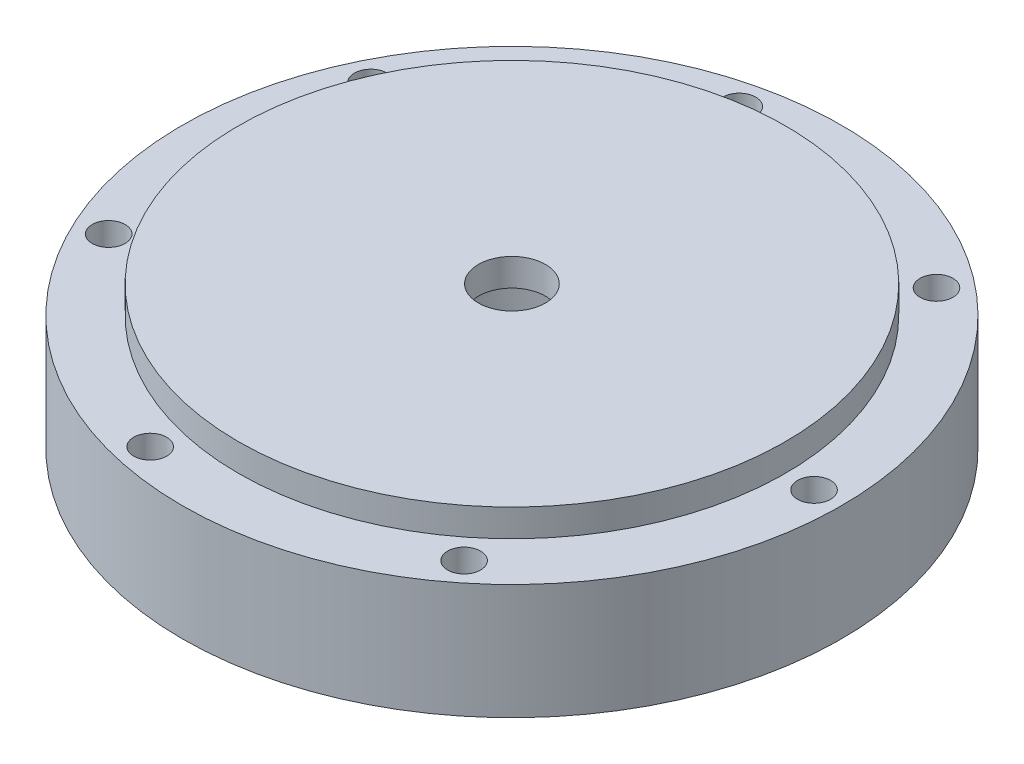
from build123d import *

# Parameters (mm, degrees)
CROQUIS1_R              = 24.9
CROQUIS1_R_2            = 3.05
SALIENTE_EXTRUIR1_DEPTH = 2.5
CROQUIS2_R              = 30
SALIENTE_EXTRUIR2_DEPTH = 10.5
CROQUIS3_R              = 1.5
CORTAR_EXTRUIR1_DEPTH   = 44.706406853


with BuildPart() as part:
    # Croquis1 → Saliente-Extruir1 (new body)
    with BuildSketch(Plane(origin=(0, 0, 0), x_dir=(1, 0, 0), z_dir=(0, 1, 0))):
        with Locations(Location((0, 0, 0), (0, 0, 270))):
            Circle(CROQUIS1_R)
        with Locations(Location((0, 0, 0), (0, 0, 270))):
            Circle(CROQUIS1_R_2, mode=Mode.SUBTRACT)
    extrude(amount=SALIENTE_EXTRUIR1_DEPTH)

    # Croquis2 → Saliente-Extruir2 (add)
    with BuildSketch(Plane(origin=(0, 0, 0), x_dir=(1, 0, 0), z_dir=(0, 1, 0))):
        with Locations(Location((0, 0, 0), (0, 0, 270))):
            Circle(CROQUIS2_R)
        with BuildLine():
            Line((-4.135214626, 9.05), (4.135214626, 9.05))
            ThreePointArc((4.135214626, 9.05), (4.370264873, 9.021983221), (4.592144419, 8.939502762))
            ThreePointArc((4.592144419, 8.939502762), (10.05, 0), (4.592144419, -8.939502762))
            ThreePointArc((4.592144419, -8.939502762), (4.370264873, -9.021983221), (4.135214626, -9.05))
            Line((4.135214626, -9.05), (-4.135214626, -9.05))
            ThreePointArc((-4.135214626, -9.05), (-4.370264873, -9.021983221), (-4.592144419, -8.939502762))
            ThreePointArc((-4.592144419, -8.939502762), (-10.05, 0), (-4.592144419, 8.939502762))
            ThreePointArc((-4.592144419, 8.939502762), (-4.370264873, 9.021983221), (-4.135214626, 9.05))
        make_face(mode=Mode.SUBTRACT)
    extrude(amount=-SALIENTE_EXTRUIR2_DEPTH)

    # Croquis3 → Cortar-Extruir1 (cut, through all)
    with BuildSketch(Plane(origin=(0, 0, 0), x_dir=(1, 0, 0), z_dir=(0, 1, 0))):
        with Locations(Location((27.5, 0, 0), (0, 0, 270))):
            Circle(CROQUIS3_R)
        with Locations(Location((17.145969551, -21.500365768, 0), (0, 0, 270))):
            Circle(CROQUIS3_R)
        with Locations(Location((-6.119325684, -26.810517585, 0), (0, 0, 270))):
            Circle(CROQUIS3_R)
        with Locations(Location((-24.776643867, -11.931802826, 0), (0, 0, 270))):
            Circle(CROQUIS3_R)
        with Locations(Location((-24.776643867, 11.931802826, 0), (0, 0, 270))):
            Circle(CROQUIS3_R)
        with Locations(Location((-6.119325684, 26.810517585, 0), (0, 0, 270))):
            Circle(CROQUIS3_R)
        with Locations(Location((17.145969551, 21.500365768, 0), (0, 0, 270))):
            Circle(CROQUIS3_R)
    extrude(amount=-CORTAR_EXTRUIR1_DEPTH, mode=Mode.SUBTRACT)


solid = part.part
